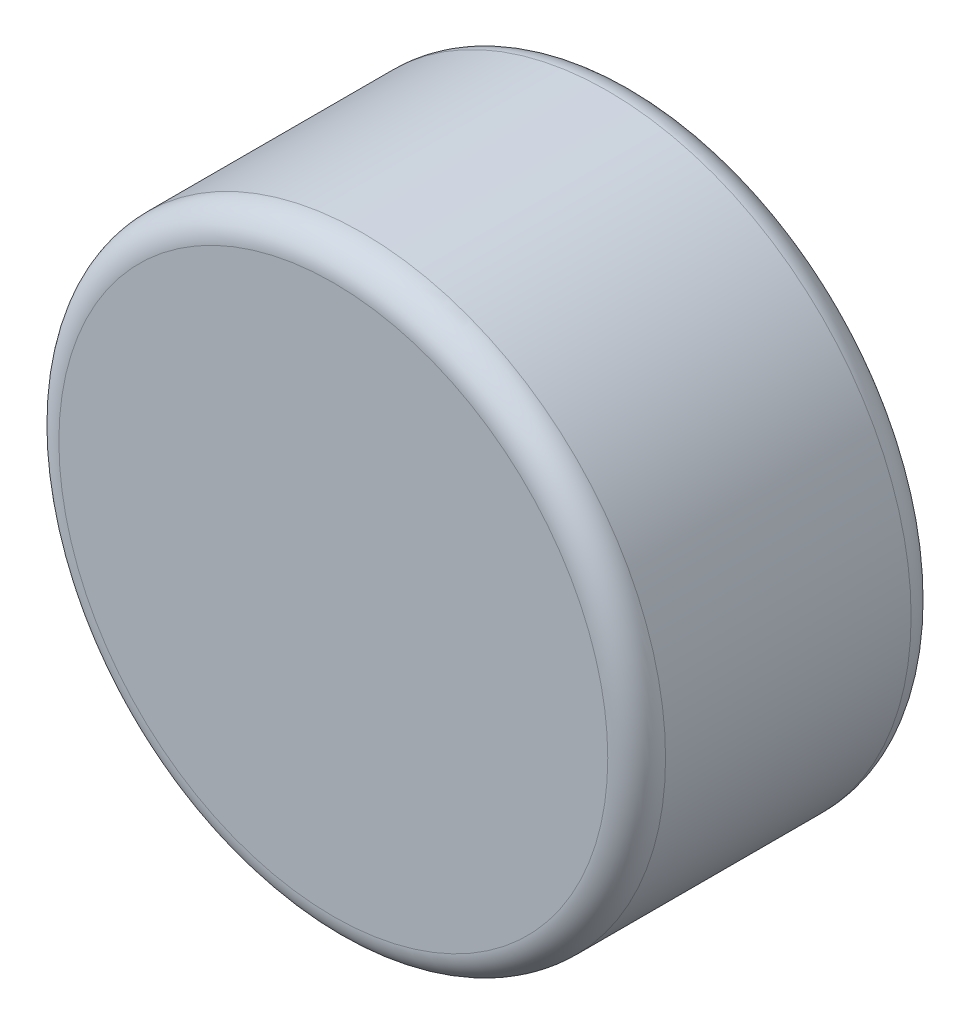
from build123d import *

# Parameters (mm, degrees)
SKETCH1_R           = 3.15
BOSS_EXTRUDE1_DEPTH = 3.15
FILLET1_R           = 0.3


with BuildPart() as part:
    # Sketch1 → Boss-Extrude1 (new body)
    with BuildSketch(Plane.XY):
        Circle(SKETCH1_R)
    extrude(amount=BOSS_EXTRUDE1_DEPTH)

    # Fillet1
    fillet1_edges = [part.edges().sort_by_distance(p)[0] for p in [
        (-3.15, 0, 0),
        (-3.15, 0, 3.15),
    ]]
    fillet(fillet1_edges, radius=FILLET1_R)


solid = part.part
